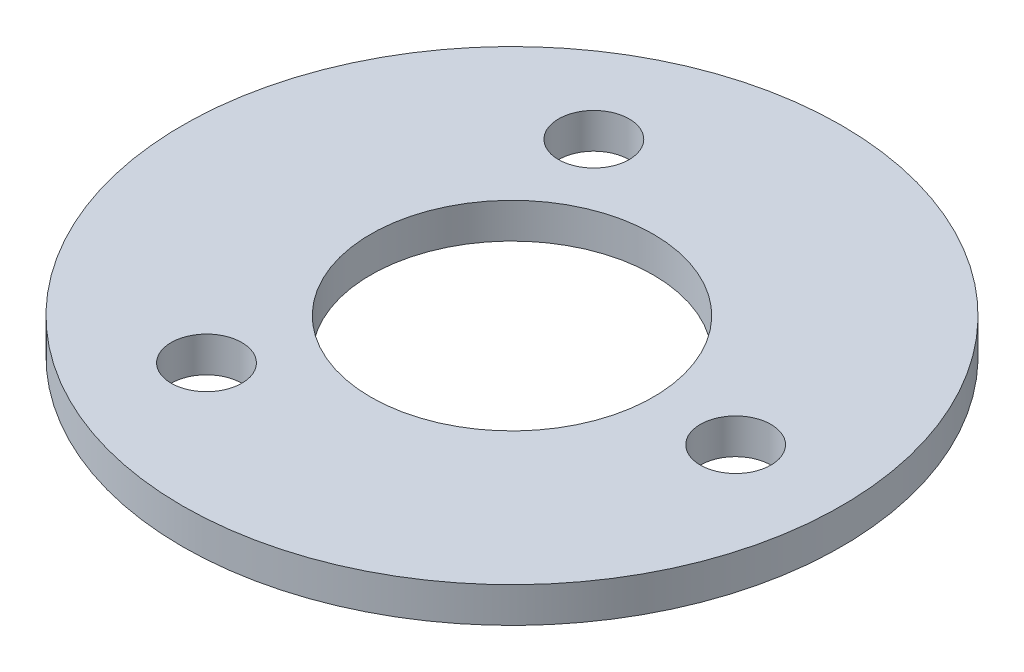
from build123d import *

# Parameters (mm, degrees)
SKETCH_1_R          = 14
SKETCH_1_R_2        = 6
EXTRUDE_1_DEPTH     = 1.5
CUT_EXTRUDE_2_REACH = 21.856
SKETCH_2_R          = 1.5


with BuildPart() as part:
    # 草图1 → 凸台-拉伸1 (new body)
    with BuildSketch(Plane(origin=(0, 0, 0), x_dir=(1, 0, 0), z_dir=(0, 1, 0))):
        with Locations(Location((0, 0, 0), (0, 0, 270))):
            Circle(SKETCH_1_R)
        with Locations(Location((0, 0, 0), (0, 0, 270))):
            Circle(SKETCH_1_R_2, mode=Mode.SUBTRACT)
    extrude(amount=EXTRUDE_1_DEPTH)

    # 草图2 → 切除-拉伸2 (cut, up to next)
    with BuildSketch(Plane(origin=(0, 0, 0), x_dir=(1, 0, 0), z_dir=(0, 1, 0)), mode=Mode.PRIVATE) as cut_extrude_2_sk1:
        with Locations(Location((9.5, 0, 0), (0, 0, 270))):
            Circle(SKETCH_2_R)
    cut_extrude_2_tool1 = extrude(cut_extrude_2_sk1.sketch, amount=CUT_EXTRUDE_2_REACH, mode=Mode.PRIVATE) & part.part
    # 草图2 → 切除-拉伸2 (cut, up to next)
    with BuildSketch(Plane(origin=(0, 0, 0), x_dir=(1, 0, 0), z_dir=(0, 1, 0)), mode=Mode.PRIVATE) as cut_extrude_2_sk2:
        with Locations(Location((-4.75, -8.227241336, 0), (0, 0, 270))):
            Circle(SKETCH_2_R)
    cut_extrude_2_tool2 = extrude(cut_extrude_2_sk2.sketch, amount=CUT_EXTRUDE_2_REACH, mode=Mode.PRIVATE) & part.part
    # 草图2 → 切除-拉伸2 (cut, up to next)
    with BuildSketch(Plane(origin=(0, 0, 0), x_dir=(1, 0, 0), z_dir=(0, 1, 0)), mode=Mode.PRIVATE) as cut_extrude_2_sk3:
        with Locations(Location((-4.75, 8.227241336, 0), (0, 0, 270))):
            Circle(SKETCH_2_R)
    cut_extrude_2_tool3 = extrude(cut_extrude_2_sk3.sketch, amount=CUT_EXTRUDE_2_REACH, mode=Mode.PRIVATE) & part.part
    add(cut_extrude_2_tool1.solids().sort_by_distance((9.5, 0, 0))[0], mode=Mode.SUBTRACT)
    add(cut_extrude_2_tool2.solids().sort_by_distance((-4.75, 0, 8.227241))[0], mode=Mode.SUBTRACT)
    add(cut_extrude_2_tool3.solids().sort_by_distance((-4.75, 0, -8.227241))[0], mode=Mode.SUBTRACT)


solid = part.part
